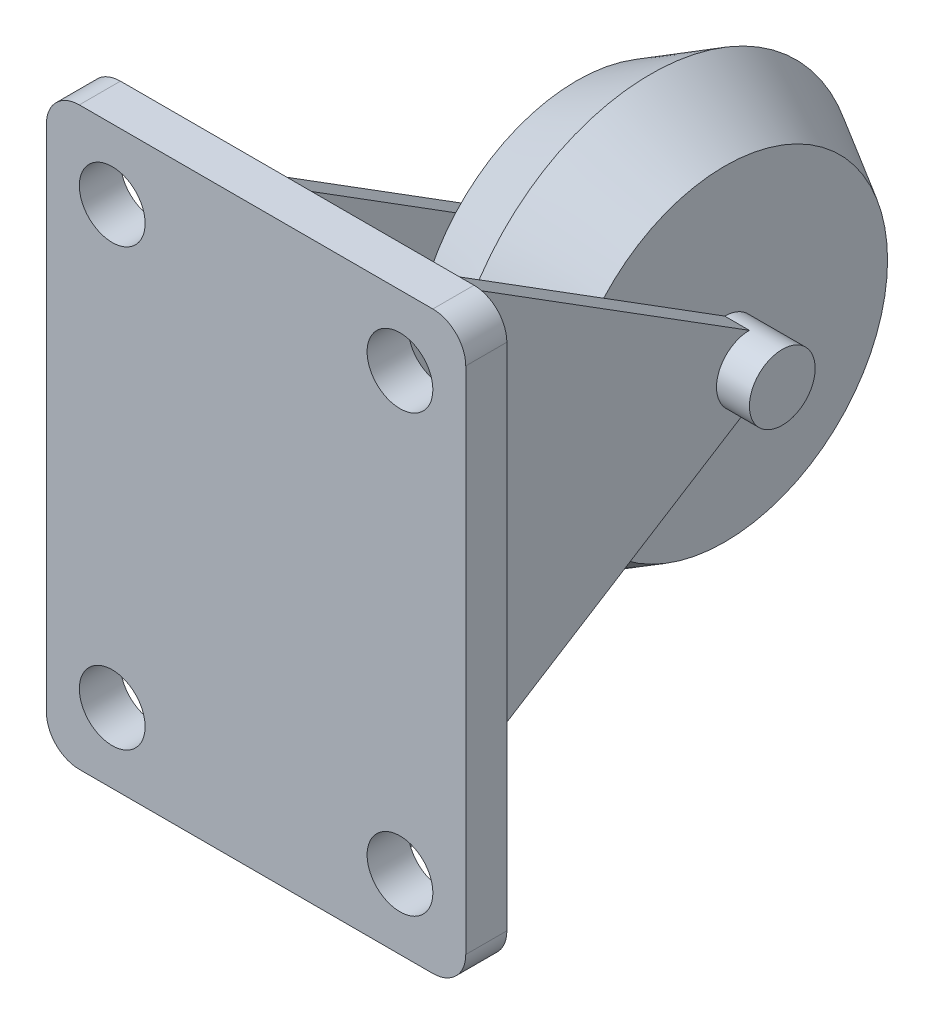
from build123d import *

# Parameters (mm, degrees)
SKETCH_1_R                = 4
EXTRUDE_1_DEPTH           = 5
EXTRUDE_2_DEPTH           = 12
EXTRUDE_2_DEPTH_BACK      = 12
EXTRUDE_3_DEPTH           = 16
EXTRUDE_3_DEPTH_BACK      = 16
CUT_EXTRUDE_1_DEPTH       = 9
CUT_EXTRUDE_1_DEPTH_BACK  = 9
SKETCH_2_5_R              = 25
EXTRUDE_4_DEPTH           = 9
EXTRUDE_4_TAPER           = 30
EXTRUDE_4_OTHER_WAY_DEPTH = 9
EXTRUDE_4_OTHER_WAY_TAPER = 30


with BuildPart() as part:
    # 草图1 → 凸台-拉伸1 (new body)
    with BuildSketch(Plane.XY):
        with BuildLine():
            Line((21.5, -35), (-21.5, -35))
            ThreePointArc((-21.5, -35), (-24.328427125, -33.828427125), (-25.5, -31))
            Line((-25.5, -31), (-25.5, 31))
            ThreePointArc((-25.5, 31), (-24.328427125, 33.828427125), (-21.5, 35))
            Line((-21.5, 35), (21.5, 35))
            ThreePointArc((21.5, 35), (24.328427125, 33.828427125), (25.5, 31))
            Line((25.5, 31), (25.5, -31))
            ThreePointArc((25.5, -31), (24.328427125, -33.828427125), (21.5, -35))
        make_face()
        with Locations((-17.5, 26.5)):
            Circle(SKETCH_1_R, mode=Mode.SUBTRACT)
        with Locations((17.5, 26.5)):
            Circle(SKETCH_1_R, mode=Mode.SUBTRACT)
        with Locations((17.5, -26.5)):
            Circle(SKETCH_1_R, mode=Mode.SUBTRACT)
        with Locations((-17.5, -26.5)):
            Circle(SKETCH_1_R, mode=Mode.SUBTRACT)
    extrude(amount=EXTRUDE_1_DEPTH)

    # 草图2 → 凸台-拉伸2 (add, two sides: drawn at the far end of the back side and taken through both)
    with BuildSketch(Plane(origin=(0, 0, 0), x_dir=(0, 0, -1), z_dir=(1, 0, 0)).offset(-EXTRUDE_2_DEPTH_BACK)):
        with BuildLine():
            ThreePointArc((43, -4), (39, 0), (43, 4))
            Line((43, 4), (0, 31))
            Line((0, 31), (0, -31))
            Line((0, -31), (43, -4))
        make_face()
    extrude(amount=EXTRUDE_2_DEPTH + EXTRUDE_2_DEPTH_BACK)

    # 草图2<3> → 凸台-拉伸3 (add, two sides: drawn at the far end of the back side and taken through both)
    with BuildSketch(Plane(origin=(0, 0, 0), x_dir=(0, 0, -1), z_dir=(1, 0, 0)).offset(-EXTRUDE_3_DEPTH_BACK)):
        with BuildLine():
            ThreePointArc((47, 0), (45.828427125, 2.828427125), (43, 4))
            ThreePointArc((43, 4), (39, 0), (43, -4))
            ThreePointArc((43, -4), (45.828427125, -2.828427125), (47, 0))
        make_face()
    extrude(amount=EXTRUDE_3_DEPTH + EXTRUDE_3_DEPTH_BACK)

    # 草图2<4> → 切除-拉伸1 (cut, two sides: drawn at the far end of the back side and taken through both)
    with BuildSketch(Plane(origin=(0, 0, 0), x_dir=(0, 0, -1), z_dir=(1, 0, 0)).offset(-CUT_EXTRUDE_1_DEPTH_BACK)):
        with BuildLine():
            ThreePointArc((43, -4), (47, 0), (43, 4))
            Line((43, 4), (0, 31))
            Line((0, 31), (0, -31))
            Line((0, -31), (43, -4))
        make_face()
    extrude(amount=CUT_EXTRUDE_1_DEPTH + CUT_EXTRUDE_1_DEPTH_BACK, mode=Mode.SUBTRACT)

    # 草图2<5> → 凸台-拉伸4 (add)
    with BuildSketch(Plane(origin=(0, 0, 0), x_dir=(0, 0, -1), z_dir=(1, 0, 0))):
        with Locations((43, 0)):
            Circle(SKETCH_2_5_R)
    extrude(amount=EXTRUDE_4_DEPTH, taper=EXTRUDE_4_TAPER)

    # 草图2<5> → 凸台-拉伸4 other way (add)
    with BuildSketch(Plane(origin=(0, 0, 0), x_dir=(0, 0, -1), z_dir=(1, 0, 0))):
        with Locations((43, 0)):
            Circle(SKETCH_2_5_R)
    extrude(amount=-EXTRUDE_4_OTHER_WAY_DEPTH, taper=EXTRUDE_4_OTHER_WAY_TAPER)


solid = part.part
